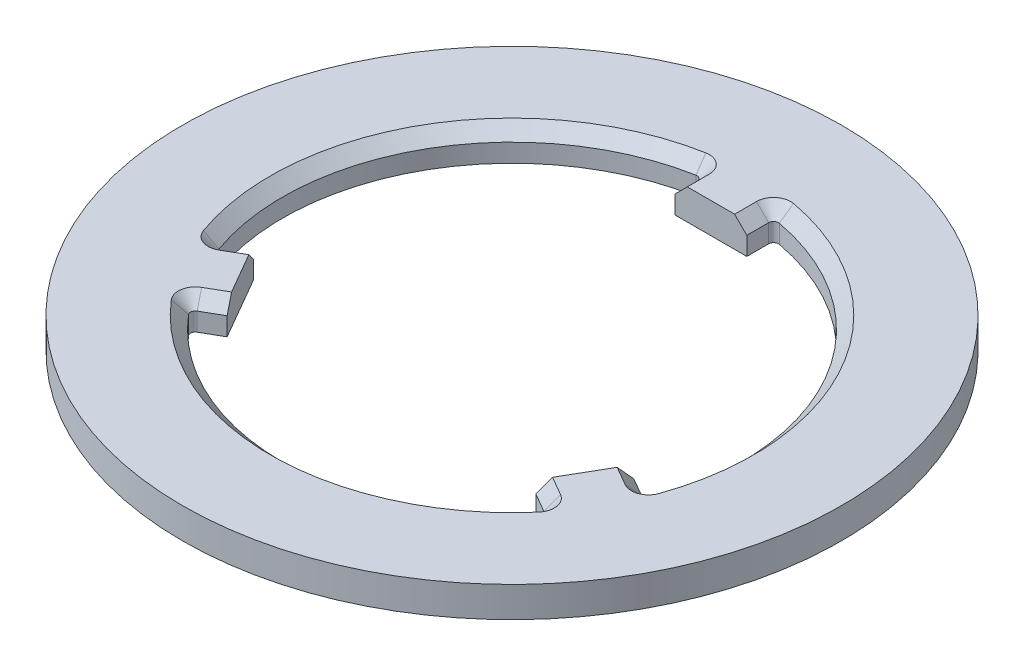
from build123d import *

# Parameters (mm, degrees)
SKETCH1_R                = 54
SKETCH1_R_2              = 37.6
BOSS_EXTRUDE1_DEPTH      = 2.5
BOSS_EXTRUDE2_DEPTH      = 2.5
FILLET1_R                = 0.8
CIRPATTERN1_COUNT        = 3
FILLET1_OF_CIRPATTERN1_R = 0.8
CHAMFER2_SIZE            = 2


with BuildPart() as part:
    # Sketch1 → Boss-Extrude1 (new, symmetric)
    with BuildSketch(Plane(origin=(0, 0, 0), x_dir=(1, 0, 0), z_dir=(0, 1, 0))):
        with Locations(Location((0, 0, 0), (0, 0, 270))):
            Circle(SKETCH1_R)
        with Locations(Location((0, 0, 0), (0, 0, 270))):
            Circle(SKETCH1_R_2, mode=Mode.SUBTRACT)
    extrude(amount=BOSS_EXTRUDE1_DEPTH, both=True)

    # Sketch2 → Boss-Extrude2 (add, symmetric)
    with BuildSketch(Plane(origin=(0, 0, 0), x_dir=(1, 0, 0), z_dir=(0, 1, 0))):
        with BuildLine():
            Line((-5.875, 32.6), (5.875, 32.6))
            Line((5.875, 32.6), (5.875, 37.138179479))
            ThreePointArc((5.875, 37.138179479), (0, 37.6), (-5.875, 37.138179479))
            Line((-5.875, 37.138179479), (-5.875, 32.6))
        make_face()
    boss_extrude2 = extrude(amount=BOSS_EXTRUDE2_DEPTH, both=True)

    # Fillet1
    fillet1_edges = [part.edges().sort_by_distance(p)[0] for p in [
        (-5.875, 0, -37.138179479),
        (5.875, 0, -37.138179479),
    ]]
    fillet(fillet1_edges, radius=FILLET1_R)

    # CirPattern1: Boss-Extrude2 ×3 about axis
    cirpattern1_axis = Axis((0, 0, 0), (0, 1, 0))
    for i in range(1, CIRPATTERN1_COUNT):
        add(boss_extrude2.rotate(cirpattern1_axis, i * 360 / CIRPATTERN1_COUNT))

    # Fillet1 of CirPattern1
    fillet1_of_cirpattern1_edges = [part.edges().sort_by_distance(p)[0] for p in [
        (-29.225106879, 0, 23.656988987),
        (-35.100106879, 0, 13.481190492),
        (35.100106879, 0, 13.481190492),
        (29.225106879, 0, 23.656988987),
    ]]
    fillet(fillet1_of_cirpattern1_edges, radius=FILLET1_OF_CIRPATTERN1_R)

    # Chamfer2
    chamfer2_edges = [part.edges().sort_by_distance(p)[0] for p in [
        (5.875, 2.5, -34.394780843),
        (-32.562555182, 2.5, -18.8),
        (-5.875, 2.5, -34.394780843),
        (6.163183117, 2.5, -36.804414089),
        (-6.163183117, 2.5, -36.804414089),
        (26.849253967, 2.5, 22.285289669),
        (-32.724253967, 2.5, 12.109491174),
        (32.724253967, 2.5, 12.109491174),
        (32.562555182, 2.5, -18.8),
        (28.791966014, 2.5, 23.739680192),
        (34.955149131, 2.5, 13.064733897),
        (-26.849253967, 2.5, 22.285289669),
        (0, 2.5, 37.6),
        (-34.955149131, 2.5, 13.064733897),
        (-28.791966014, 2.5, 23.739680192),
    ]]
    chamfer(chamfer2_edges, length=CHAMFER2_SIZE)


solid = part.part
